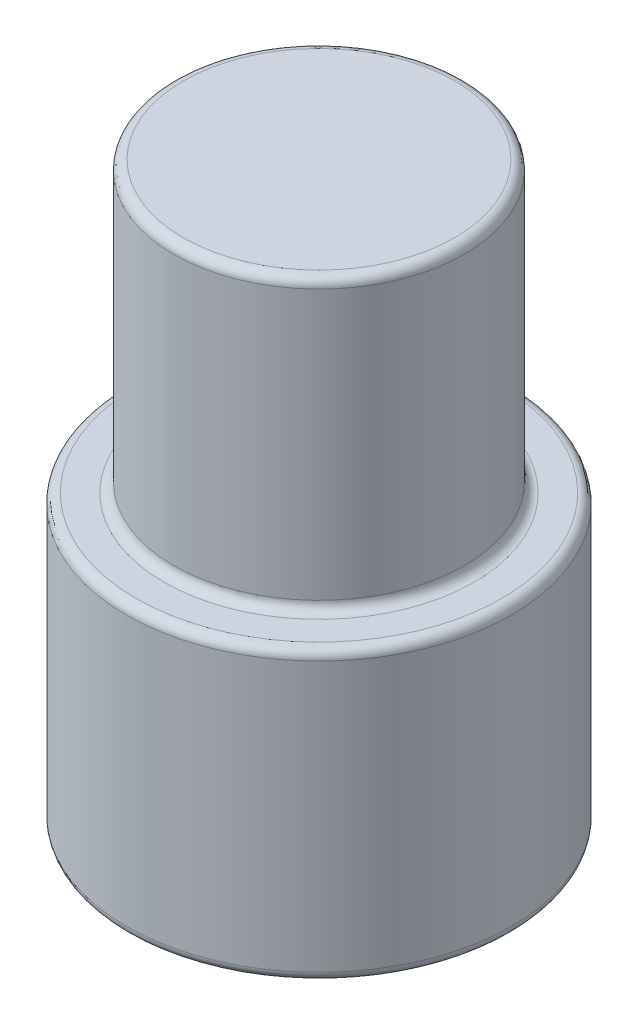
from build123d import *

# Parameters (mm, degrees)
SKETCH1_R           = 10
BOSS_EXTRUDE1_DEPTH = 15
SKETCH2_R           = 7.55
BOSS_EXTRUDE2_DEPTH = 15
FILLET1_R           = 0.5


with BuildPart() as part:
    # Sketch1 → Boss-Extrude1 (new body)
    with BuildSketch(Plane(origin=(0, 0, 0), x_dir=(1, 0, 0), z_dir=(0, 1, 0))):
        with Locations(Location((0, 0, 0), (0, 0, 270))):
            Circle(SKETCH1_R)
    extrude(amount=BOSS_EXTRUDE1_DEPTH)

    # Sketch2 → Boss-Extrude2 (add)
    with BuildSketch(Plane(origin=(0, 15, 0), x_dir=(1, 0, 0), z_dir=(0, 1, 0))):
        with Locations(Location((0, 0, 0), (0, 0, 270))):
            Circle(SKETCH2_R)
    extrude(amount=BOSS_EXTRUDE2_DEPTH)

    # Fillet1
    fillet1_edges = [part.edges().sort_by_distance(p)[0] for p in [
        (0, 0, -10),
        (0, 15, -10),
        (0, 15, -7.55),
        (0, 30, -7.55),
    ]]
    fillet(fillet1_edges, radius=FILLET1_R)


solid = part.part
